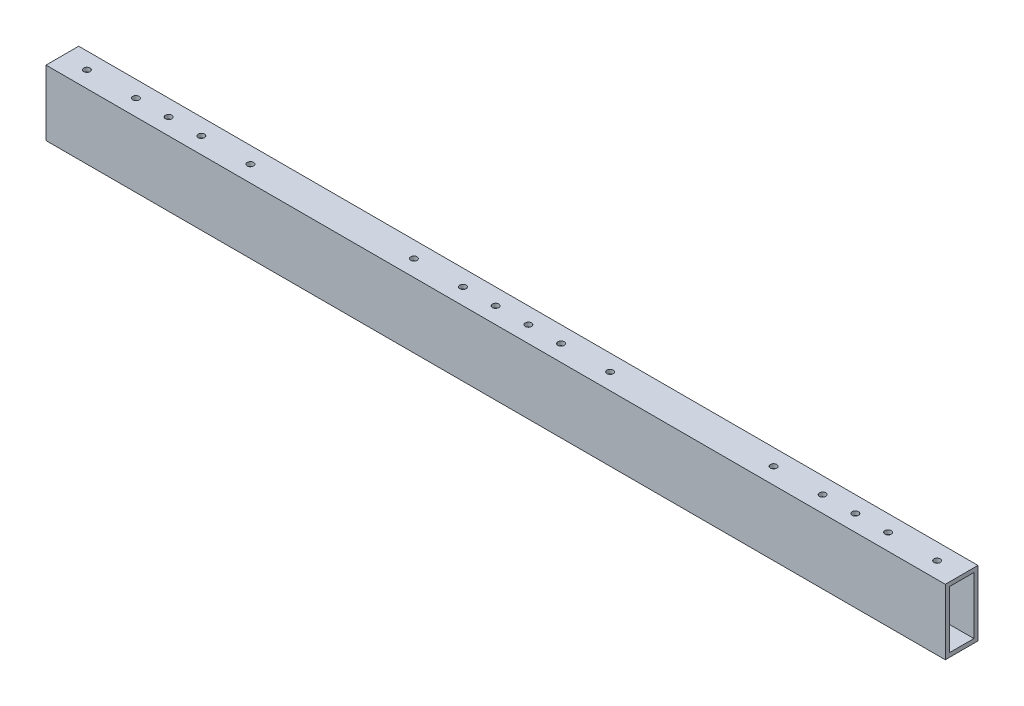
from build123d import *

# Parameters (mm, degrees)
BOSS_EXTRUDE1_DEPTH      = 349.25
BOSS_EXTRUDE1_DEPTH_BACK = 349.25
SKETCH1_W                = 25.4
SKETCH1_H                = 50.8
SKETCH1_W_2              = 19.05
SKETCH1_H_2              = 44.45
CUT_EXTRUDE1_REACH       = 355.624
SKETCH6_R                = 2.4638
CUT_EXTRUDE2_REACH       = 355.624
SKETCH7_R                = 2.4638


with BuildPart() as part:
    # Sketch1 → Boss-Extrude1 (new, two sides: drawn at the far end of the back side and taken through both)
    with BuildSketch(Plane(origin=(0, 0, 0), x_dir=(0, 0, -1), z_dir=(1, 0, 0)).offset(-BOSS_EXTRUDE1_DEPTH_BACK)):
        with Locations((-9.525, 22.225)):
            Rectangle(SKETCH1_W, SKETCH1_H)
        with Locations((-9.525, 22.225)):
            Rectangle(SKETCH1_W_2, SKETCH1_H_2, mode=Mode.SUBTRACT)
    extrude(amount=BOSS_EXTRUDE1_DEPTH + BOSS_EXTRUDE1_DEPTH_BACK)

    # Sketch6 → Cut-Extrude1 (cut, up to next)
    with BuildSketch(Plane(origin=(0, 47.625, 0), x_dir=(1, 0, 0), z_dir=(0, 1, 0)), mode=Mode.PRIVATE) as cut_extrude1_sk1:
        with Locations((330.2, -9.525)):
            Circle(SKETCH6_R)
    cut_extrude1_tool1 = extrude(cut_extrude1_sk1.sketch, amount=-CUT_EXTRUDE1_REACH, mode=Mode.PRIVATE) & part.part
    # Sketch6 → Cut-Extrude1 (cut, up to next)
    with BuildSketch(Plane(origin=(0, 47.625, 0), x_dir=(1, 0, 0), z_dir=(0, 1, 0)), mode=Mode.PRIVATE) as cut_extrude1_sk2:
        with Locations((292.1, -9.525)):
            Circle(SKETCH6_R)
    cut_extrude1_tool2 = extrude(cut_extrude1_sk2.sketch, amount=-CUT_EXTRUDE1_REACH, mode=Mode.PRIVATE) & part.part
    # Sketch6 → Cut-Extrude1 (cut, up to next)
    with BuildSketch(Plane(origin=(0, 47.625, 0), x_dir=(1, 0, 0), z_dir=(0, 1, 0)), mode=Mode.PRIVATE) as cut_extrude1_sk3:
        with Locations((266.7, -9.525)):
            Circle(SKETCH6_R)
    cut_extrude1_tool3 = extrude(cut_extrude1_sk3.sketch, amount=-CUT_EXTRUDE1_REACH, mode=Mode.PRIVATE) & part.part
    # Sketch6 → Cut-Extrude1 (cut, up to next)
    with BuildSketch(Plane(origin=(0, 47.625, 0), x_dir=(1, 0, 0), z_dir=(0, 1, 0)), mode=Mode.PRIVATE) as cut_extrude1_sk4:
        with Locations((241.3, -9.525)):
            Circle(SKETCH6_R)
    cut_extrude1_tool4 = extrude(cut_extrude1_sk4.sketch, amount=-CUT_EXTRUDE1_REACH, mode=Mode.PRIVATE) & part.part
    # Sketch6 → Cut-Extrude1 (cut, up to next)
    with BuildSketch(Plane(origin=(0, 47.625, 0), x_dir=(1, 0, 0), z_dir=(0, 1, 0)), mode=Mode.PRIVATE) as cut_extrude1_sk5:
        with Locations((203.2, -9.525)):
            Circle(SKETCH6_R)
    cut_extrude1_tool5 = extrude(cut_extrude1_sk5.sketch, amount=-CUT_EXTRUDE1_REACH, mode=Mode.PRIVATE) & part.part
    # Sketch6 → Cut-Extrude1 (cut, up to next)
    with BuildSketch(Plane(origin=(0, 47.625, 0), x_dir=(1, 0, 0), z_dir=(0, 1, 0)), mode=Mode.PRIVATE) as cut_extrude1_sk6:
        with Locations((76.2, -9.525)):
            Circle(SKETCH6_R)
    cut_extrude1_tool6 = extrude(cut_extrude1_sk6.sketch, amount=-CUT_EXTRUDE1_REACH, mode=Mode.PRIVATE) & part.part
    # Sketch6 → Cut-Extrude1 (cut, up to next)
    with BuildSketch(Plane(origin=(0, 47.625, 0), x_dir=(1, 0, 0), z_dir=(0, 1, 0)), mode=Mode.PRIVATE) as cut_extrude1_sk7:
        with Locations((38.1, -9.525)):
            Circle(SKETCH6_R)
    cut_extrude1_tool7 = extrude(cut_extrude1_sk7.sketch, amount=-CUT_EXTRUDE1_REACH, mode=Mode.PRIVATE) & part.part
    # Sketch6 → Cut-Extrude1 (cut, up to next)
    with BuildSketch(Plane(origin=(0, 47.625, 0), x_dir=(1, 0, 0), z_dir=(0, 1, 0)), mode=Mode.PRIVATE) as cut_extrude1_sk8:
        with Locations((12.7, -9.525)):
            Circle(SKETCH6_R)
    cut_extrude1_tool8 = extrude(cut_extrude1_sk8.sketch, amount=-CUT_EXTRUDE1_REACH, mode=Mode.PRIVATE) & part.part
    # Sketch6 → Cut-Extrude1 (cut, up to next)
    with BuildSketch(Plane(origin=(0, 47.625, 0), x_dir=(1, 0, 0), z_dir=(0, 1, 0)), mode=Mode.PRIVATE) as cut_extrude1_sk9:
        with Locations((-12.7, -9.525)):
            Circle(SKETCH6_R)
    cut_extrude1_tool9 = extrude(cut_extrude1_sk9.sketch, amount=-CUT_EXTRUDE1_REACH, mode=Mode.PRIVATE) & part.part
    # Sketch6 → Cut-Extrude1 (cut, up to next)
    with BuildSketch(Plane(origin=(0, 47.625, 0), x_dir=(1, 0, 0), z_dir=(0, 1, 0)), mode=Mode.PRIVATE) as cut_extrude1_sk10:
        with Locations((-38.1, -9.525)):
            Circle(SKETCH6_R)
    cut_extrude1_tool10 = extrude(cut_extrude1_sk10.sketch, amount=-CUT_EXTRUDE1_REACH, mode=Mode.PRIVATE) & part.part
    # Sketch6 → Cut-Extrude1 (cut, up to next)
    with BuildSketch(Plane(origin=(0, 47.625, 0), x_dir=(1, 0, 0), z_dir=(0, 1, 0)), mode=Mode.PRIVATE) as cut_extrude1_sk11:
        with Locations((-76.2, -9.525)):
            Circle(SKETCH6_R)
    cut_extrude1_tool11 = extrude(cut_extrude1_sk11.sketch, amount=-CUT_EXTRUDE1_REACH, mode=Mode.PRIVATE) & part.part
    # Sketch6 → Cut-Extrude1 (cut, up to next)
    with BuildSketch(Plane(origin=(0, 47.625, 0), x_dir=(1, 0, 0), z_dir=(0, 1, 0)), mode=Mode.PRIVATE) as cut_extrude1_sk12:
        with Locations((-203.2, -9.525)):
            Circle(SKETCH6_R)
    cut_extrude1_tool12 = extrude(cut_extrude1_sk12.sketch, amount=-CUT_EXTRUDE1_REACH, mode=Mode.PRIVATE) & part.part
    # Sketch6 → Cut-Extrude1 (cut, up to next)
    with BuildSketch(Plane(origin=(0, 47.625, 0), x_dir=(1, 0, 0), z_dir=(0, 1, 0)), mode=Mode.PRIVATE) as cut_extrude1_sk13:
        with Locations((-241.3, -9.525)):
            Circle(SKETCH6_R)
    cut_extrude1_tool13 = extrude(cut_extrude1_sk13.sketch, amount=-CUT_EXTRUDE1_REACH, mode=Mode.PRIVATE) & part.part
    # Sketch6 → Cut-Extrude1 (cut, up to next)
    with BuildSketch(Plane(origin=(0, 47.625, 0), x_dir=(1, 0, 0), z_dir=(0, 1, 0)), mode=Mode.PRIVATE) as cut_extrude1_sk14:
        with Locations((-330.2, -9.525)):
            Circle(SKETCH6_R)
    cut_extrude1_tool14 = extrude(cut_extrude1_sk14.sketch, amount=-CUT_EXTRUDE1_REACH, mode=Mode.PRIVATE) & part.part
    # Sketch6 → Cut-Extrude1 (cut, up to next)
    with BuildSketch(Plane(origin=(0, 47.625, 0), x_dir=(1, 0, 0), z_dir=(0, 1, 0)), mode=Mode.PRIVATE) as cut_extrude1_sk15:
        with Locations((-292.1, -9.525)):
            Circle(SKETCH6_R)
    cut_extrude1_tool15 = extrude(cut_extrude1_sk15.sketch, amount=-CUT_EXTRUDE1_REACH, mode=Mode.PRIVATE) & part.part
    # Sketch6 → Cut-Extrude1 (cut, up to next)
    with BuildSketch(Plane(origin=(0, 47.625, 0), x_dir=(1, 0, 0), z_dir=(0, 1, 0)), mode=Mode.PRIVATE) as cut_extrude1_sk16:
        with Locations((-266.7, -9.525)):
            Circle(SKETCH6_R)
    cut_extrude1_tool16 = extrude(cut_extrude1_sk16.sketch, amount=-CUT_EXTRUDE1_REACH, mode=Mode.PRIVATE) & part.part
    add(cut_extrude1_tool1.solids().sort_by_distance((330.2, 47.625, 9.525))[0], mode=Mode.SUBTRACT)
    add(cut_extrude1_tool2.solids().sort_by_distance((292.1, 47.625, 9.525))[0], mode=Mode.SUBTRACT)
    add(cut_extrude1_tool3.solids().sort_by_distance((266.7, 47.625, 9.525))[0], mode=Mode.SUBTRACT)
    add(cut_extrude1_tool4.solids().sort_by_distance((241.3, 47.625, 9.525))[0], mode=Mode.SUBTRACT)
    add(cut_extrude1_tool5.solids().sort_by_distance((203.2, 47.625, 9.525))[0], mode=Mode.SUBTRACT)
    add(cut_extrude1_tool6.solids().sort_by_distance((76.2, 47.625, 9.525))[0], mode=Mode.SUBTRACT)
    add(cut_extrude1_tool7.solids().sort_by_distance((38.1, 47.625, 9.525))[0], mode=Mode.SUBTRACT)
    add(cut_extrude1_tool8.solids().sort_by_distance((12.7, 47.625, 9.525))[0], mode=Mode.SUBTRACT)
    add(cut_extrude1_tool9.solids().sort_by_distance((-12.7, 47.625, 9.525))[0], mode=Mode.SUBTRACT)
    add(cut_extrude1_tool10.solids().sort_by_distance((-38.1, 47.625, 9.525))[0], mode=Mode.SUBTRACT)
    add(cut_extrude1_tool11.solids().sort_by_distance((-76.2, 47.625, 9.525))[0], mode=Mode.SUBTRACT)
    add(cut_extrude1_tool12.solids().sort_by_distance((-203.2, 47.625, 9.525))[0], mode=Mode.SUBTRACT)
    add(cut_extrude1_tool13.solids().sort_by_distance((-241.3, 47.625, 9.525))[0], mode=Mode.SUBTRACT)
    add(cut_extrude1_tool14.solids().sort_by_distance((-330.2, 47.625, 9.525))[0], mode=Mode.SUBTRACT)
    add(cut_extrude1_tool15.solids().sort_by_distance((-292.1, 47.625, 9.525))[0], mode=Mode.SUBTRACT)
    add(cut_extrude1_tool16.solids().sort_by_distance((-266.7, 47.625, 9.525))[0], mode=Mode.SUBTRACT)

    # Sketch7 → Cut-Extrude2 (cut, up to next)
    with BuildSketch(Plane(origin=(0, -3.175, 0), x_dir=(-1, 0, 0), z_dir=(0, -1, 0)), mode=Mode.PRIVATE) as cut_extrude2_sk1:
        with Locations((-266.7, -9.525)):
            Circle(SKETCH7_R)
    cut_extrude2_tool1 = extrude(cut_extrude2_sk1.sketch, amount=-CUT_EXTRUDE2_REACH, mode=Mode.PRIVATE) & part.part
    # Sketch7 → Cut-Extrude2 (cut, up to next)
    with BuildSketch(Plane(origin=(0, -3.175, 0), x_dir=(-1, 0, 0), z_dir=(0, -1, 0)), mode=Mode.PRIVATE) as cut_extrude2_sk2:
        with Locations((-190.5, -9.525)):
            Circle(SKETCH7_R)
    cut_extrude2_tool2 = extrude(cut_extrude2_sk2.sketch, amount=-CUT_EXTRUDE2_REACH, mode=Mode.PRIVATE) & part.part
    # Sketch7 → Cut-Extrude2 (cut, up to next)
    with BuildSketch(Plane(origin=(0, -3.175, 0), x_dir=(-1, 0, 0), z_dir=(0, -1, 0)), mode=Mode.PRIVATE) as cut_extrude2_sk3:
        with Locations((-114.3, -9.525)):
            Circle(SKETCH7_R)
    cut_extrude2_tool3 = extrude(cut_extrude2_sk3.sketch, amount=-CUT_EXTRUDE2_REACH, mode=Mode.PRIVATE) & part.part
    # Sketch7 → Cut-Extrude2 (cut, up to next)
    with BuildSketch(Plane(origin=(0, -3.175, 0), x_dir=(-1, 0, 0), z_dir=(0, -1, 0)), mode=Mode.PRIVATE) as cut_extrude2_sk4:
        with Locations((-38.1, -9.525)):
            Circle(SKETCH7_R)
    cut_extrude2_tool4 = extrude(cut_extrude2_sk4.sketch, amount=-CUT_EXTRUDE2_REACH, mode=Mode.PRIVATE) & part.part
    # Sketch7 → Cut-Extrude2 (cut, up to next)
    with BuildSketch(Plane(origin=(0, -3.175, 0), x_dir=(-1, 0, 0), z_dir=(0, -1, 0)), mode=Mode.PRIVATE) as cut_extrude2_sk5:
        with Locations((38.1, -9.525)):
            Circle(SKETCH7_R)
    cut_extrude2_tool5 = extrude(cut_extrude2_sk5.sketch, amount=-CUT_EXTRUDE2_REACH, mode=Mode.PRIVATE) & part.part
    # Sketch7 → Cut-Extrude2 (cut, up to next)
    with BuildSketch(Plane(origin=(0, -3.175, 0), x_dir=(-1, 0, 0), z_dir=(0, -1, 0)), mode=Mode.PRIVATE) as cut_extrude2_sk6:
        with Locations((114.3, -9.525)):
            Circle(SKETCH7_R)
    cut_extrude2_tool6 = extrude(cut_extrude2_sk6.sketch, amount=-CUT_EXTRUDE2_REACH, mode=Mode.PRIVATE) & part.part
    # Sketch7 → Cut-Extrude2 (cut, up to next)
    with BuildSketch(Plane(origin=(0, -3.175, 0), x_dir=(-1, 0, 0), z_dir=(0, -1, 0)), mode=Mode.PRIVATE) as cut_extrude2_sk7:
        with Locations((190.5, -9.525)):
            Circle(SKETCH7_R)
    cut_extrude2_tool7 = extrude(cut_extrude2_sk7.sketch, amount=-CUT_EXTRUDE2_REACH, mode=Mode.PRIVATE) & part.part
    # Sketch7 → Cut-Extrude2 (cut, up to next)
    with BuildSketch(Plane(origin=(0, -3.175, 0), x_dir=(-1, 0, 0), z_dir=(0, -1, 0)), mode=Mode.PRIVATE) as cut_extrude2_sk8:
        with Locations((266.7, -9.525)):
            Circle(SKETCH7_R)
    cut_extrude2_tool8 = extrude(cut_extrude2_sk8.sketch, amount=-CUT_EXTRUDE2_REACH, mode=Mode.PRIVATE) & part.part
    add(cut_extrude2_tool1.solids().sort_by_distance((266.7, -3.175, 9.525))[0], mode=Mode.SUBTRACT)
    add(cut_extrude2_tool2.solids().sort_by_distance((190.5, -3.175, 9.525))[0], mode=Mode.SUBTRACT)
    add(cut_extrude2_tool3.solids().sort_by_distance((114.3, -3.175, 9.525))[0], mode=Mode.SUBTRACT)
    add(cut_extrude2_tool4.solids().sort_by_distance((38.1, -3.175, 9.525))[0], mode=Mode.SUBTRACT)
    add(cut_extrude2_tool5.solids().sort_by_distance((-38.1, -3.175, 9.525))[0], mode=Mode.SUBTRACT)
    add(cut_extrude2_tool6.solids().sort_by_distance((-114.3, -3.175, 9.525))[0], mode=Mode.SUBTRACT)
    add(cut_extrude2_tool7.solids().sort_by_distance((-190.5, -3.175, 9.525))[0], mode=Mode.SUBTRACT)
    add(cut_extrude2_tool8.solids().sort_by_distance((-266.7, -3.175, 9.525))[0], mode=Mode.SUBTRACT)


solid = part.part
